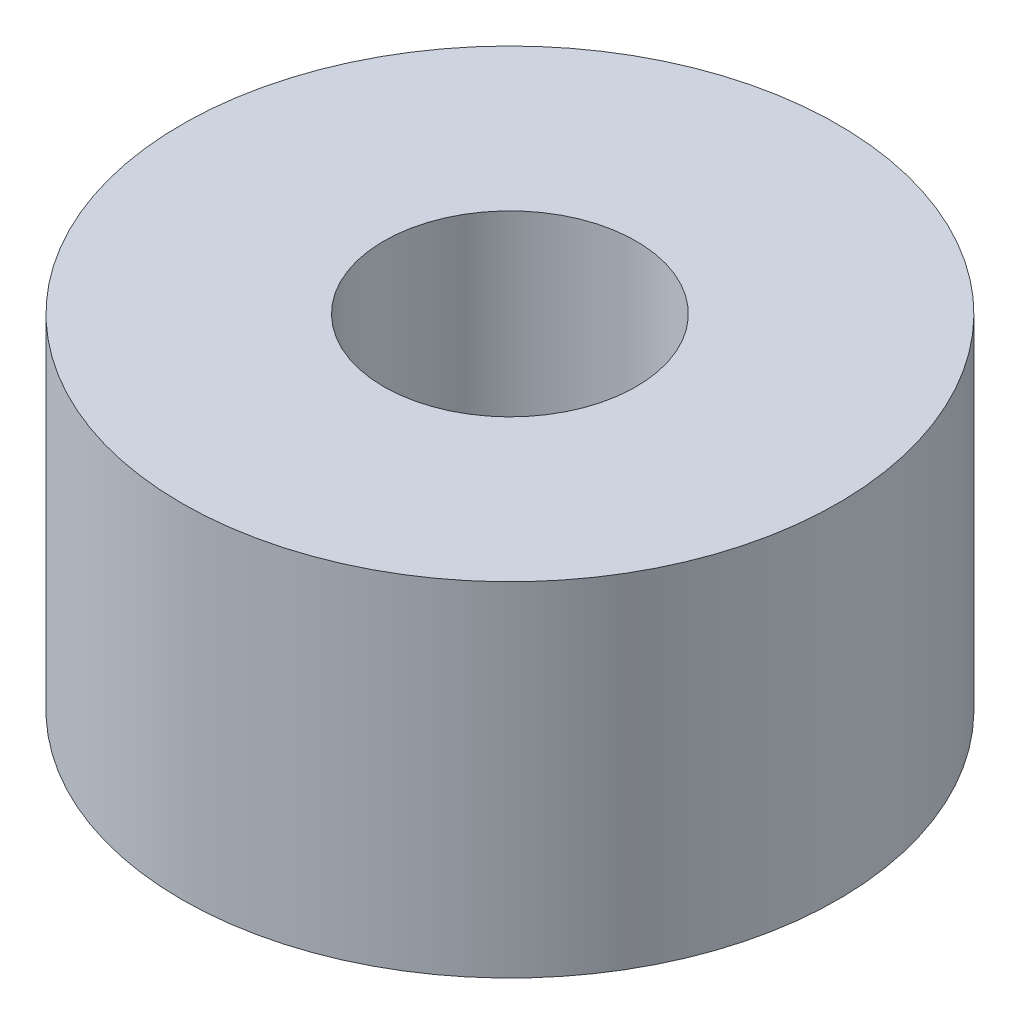
from build123d import *

# Parameters (mm, degrees)
SKETCH1_R   = 3.25
SKETCH1_R_2 = 1.25
BODY_DEPTH  = 3.4


with BuildPart() as part:
    # Sketch1 → Body (new body)
    with BuildSketch(Plane(origin=(0, 0, 0), x_dir=(1, 0, 0), z_dir=(0, 1, 0))):
        with Locations(Location((0, 0, 0), (0, 0, 270))):
            Circle(SKETCH1_R)
        with Locations(Location((0, 0, 0), (0, 0, 270))):
            Circle(SKETCH1_R_2, mode=Mode.SUBTRACT)
    extrude(amount=BODY_DEPTH)


solid = part.part
